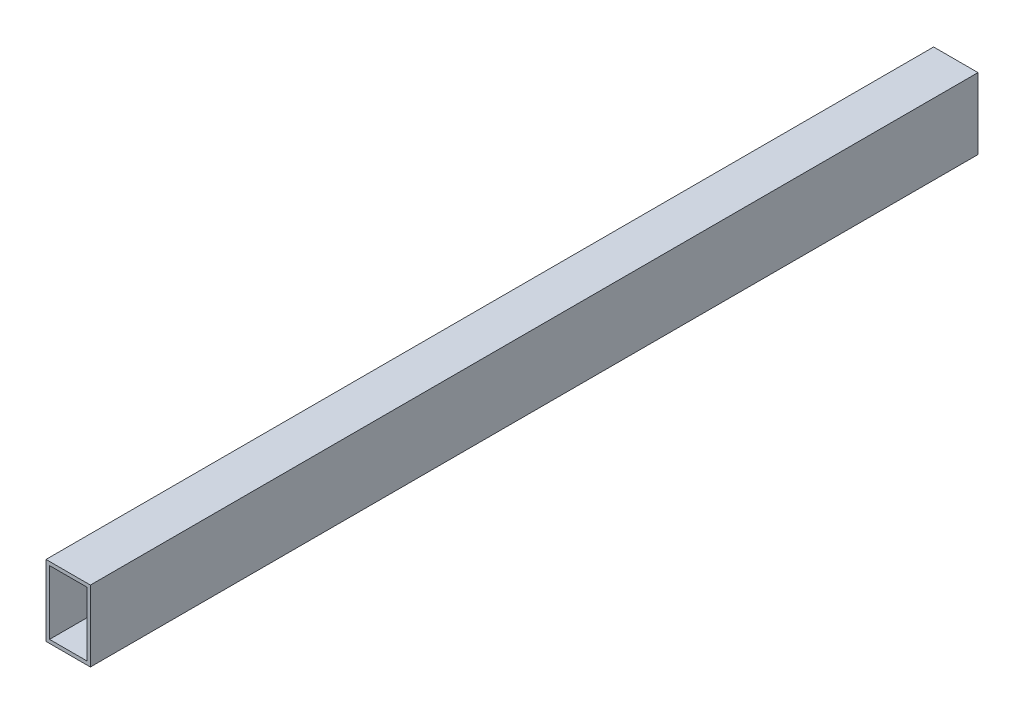
from build123d import *

# Parameters (mm, degrees)
SKETCH1_W           = 50
SKETCH1_H           = 80
BOSS_EXTRUDE1_DEPTH = 1000
SKETCH2_W           = 42
SKETCH2_H           = 72
CUT_EXTRUDE1_DEPTH  = 1000


with BuildPart() as part:
    # Sketch1 → Boss-Extrude1 (new body)
    with BuildSketch(Plane.XY):
        Rectangle(SKETCH1_W, SKETCH1_H)
    extrude(amount=BOSS_EXTRUDE1_DEPTH)

    # Sketch2 → Cut-Extrude1 (cut)
    with BuildSketch(Plane(origin=(0, 0, 0), x_dir=(-1, 0, 0), z_dir=(0, 0, -1))):
        Rectangle(SKETCH2_W, SKETCH2_H)
    extrude(amount=-CUT_EXTRUDE1_DEPTH, mode=Mode.SUBTRACT)


solid = part.part
